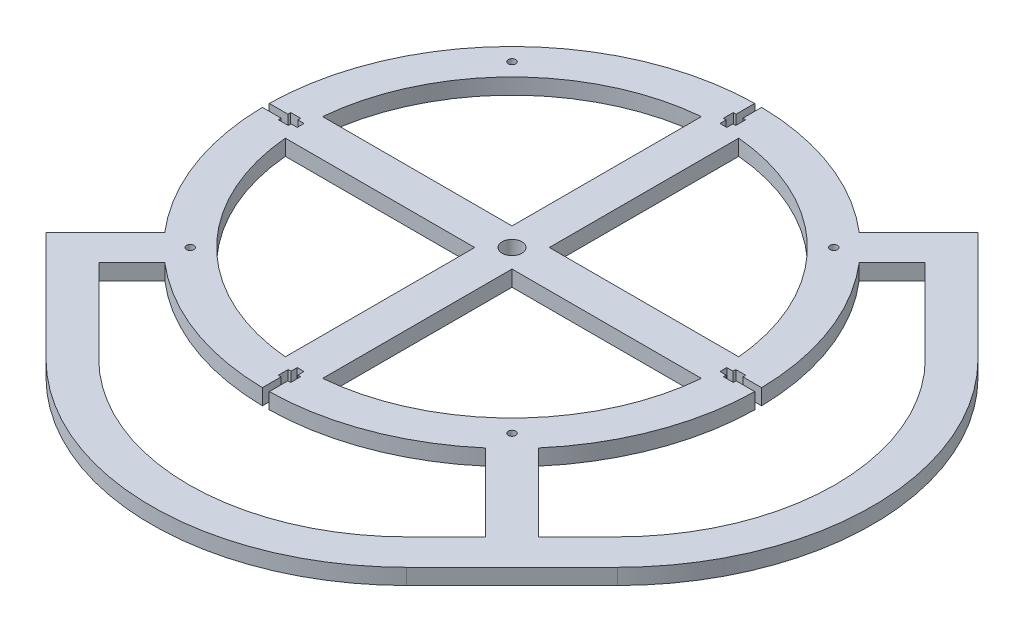
from build123d import *

# Parameters (mm, degrees)
BOSS_EXTRUDE1_DEPTH          = 3.175
SKETCH2_W                    = 2.75
SKETCH2_H                    = 2.5
SKETCH2_H_2                  = 4
SKETCH2_W_2                  = 1.125
SKETCH2_H_3                  = 7.5
CUT_EXTRUDE1_DEPTH           = 230.978807609
CIRPATTERN1_COUNT            = 4
F_3_0_3_DIAMETER_HOLE1_D     = 3
F_8_0_8_DIAMETER_HOLE1_D     = 8
F_8_0_8_DIAMETER_HOLE1_DEPTH = 6.35


with BuildPart() as part:
    # Sketch1 → Boss-Extrude1 (new, symmetric)
    with BuildSketch(Plane(origin=(0, 0, 0), x_dir=(1, 0, 0), z_dir=(0, 1, 0))):
        with BuildLine():
            Line((88.388347648, 98.994949366), (64.499098813, 75.105700531))
            ThreePointArc((64.499098813, 75.105700531), (-70.003571337, 70.003571337), (-75.105700531, -64.499098813))
            Line((-75.105700531, -64.499098813), (-98.994949366, -88.388347648))
            Line((-98.994949366, -88.388347648), (-54.800775542, -132.582521472))
            ThreePointArc((-54.800775542, -132.582521472), (17.67766953, -162.604076401), (90.156114601, -132.582521472))
            Line((90.156114601, -132.582521472), (132.582521472, -90.156114601))
            ThreePointArc((132.582521472, -90.156114601), (162.604076401, -17.67766953), (132.582521472, 54.800775542))
            Line((132.582521472, 54.800775542), (88.388347648, 98.994949366))
        make_face()
        with BuildLine():
            Line((-7.5, -7.5), (-7.5, -83.664508604))
            ThreePointArc((-7.5, -83.664508604), (-59.39696962, -59.39696962), (-83.664508604, -7.5))
            Line((-83.664508604, -7.5), (-7.5, -7.5))
        make_face(mode=Mode.SUBTRACT)
        with BuildLine():
            ThreePointArc((83.664508604, -7.5), (59.39696962, -59.39696962), (7.5, -83.664508604))
            Line((7.5, -83.664508604), (7.5, -7.5))
            Line((7.5, -7.5), (83.664508604, -7.5))
        make_face(mode=Mode.SUBTRACT)
        with BuildLine():
            ThreePointArc((-64.499098813, -75.105700531), (0, -99), (64.499098813, -75.105700531))
            Line((64.499098813, -75.105700531), (95.45941546, -106.066017178))
            Line((95.45941546, -106.066017178), (79.549512883, -121.975919755))
            ThreePointArc((79.549512883, -121.975919755), (17.67766953, -147.604076401), (-44.194173824, -121.975919755))
            Line((-44.194173824, -121.975919755), (-77.781745931, -88.388347648))
            Line((-77.781745931, -88.388347648), (-64.499098813, -75.105700531))
        make_face(mode=Mode.SUBTRACT)
        with BuildLine():
            ThreePointArc((75.105700531, -64.499098813), (99, 0), (75.105700531, 64.499098813))
            Line((75.105700531, 64.499098813), (88.388347648, 77.781745931))
            Line((88.388347648, 77.781745931), (121.975919755, 44.194173824))
            ThreePointArc((121.975919755, 44.194173824), (147.604076401, -17.67766953), (121.975919755, -79.549512883))
            Line((121.975919755, -79.549512883), (106.066017178, -95.45941546))
            Line((106.066017178, -95.45941546), (75.105700531, -64.499098813))
        make_face(mode=Mode.SUBTRACT)
        with BuildLine():
            Line((-7.5, 7.5), (-83.664508604, 7.5))
            ThreePointArc((-83.664508604, 7.5), (-59.39696962, 59.39696962), (-7.5, 83.664508604))
            Line((-7.5, 83.664508604), (-7.5, 7.5))
        make_face(mode=Mode.SUBTRACT)
        with BuildLine():
            ThreePointArc((7.5, 83.664508604), (59.39696962, 59.39696962), (83.664508604, 7.5))
            Line((83.664508604, 7.5), (7.5, 7.5))
            Line((7.5, 7.5), (7.5, 83.664508604))
        make_face(mode=Mode.SUBTRACT)
    extrude(amount=BOSS_EXTRUDE1_DEPTH, both=True)

    # Sketch2 → Cut-Extrude1 (cut, symmetric)
    with BuildSketch(Plane(origin=(0, 0, 0), x_dir=(1, 0, 0), z_dir=(0, 1, 0))):
        with Locations((0, 86.25)):
            Rectangle(SKETCH2_W, SKETCH2_H)
        with Locations((0, 89.5)):
            Rectangle(SKETCH2_W, SKETCH2_H_2)
        with Locations((1.9375, 89.5)):
            Rectangle(SKETCH2_W_2, SKETCH2_H_2)
        with Locations((0, 95.25)):
            Rectangle(SKETCH2_W, SKETCH2_H_3)
        with Locations((-1.9375, 89.5)):
            Rectangle(SKETCH2_W_2, SKETCH2_H_2)
    cut_extrude1 = extrude(amount=CUT_EXTRUDE1_DEPTH, both=True, mode=Mode.SUBTRACT)

    # CirPattern1: Cut-Extrude1 ×4 about axis
    cirpattern1_axis = Axis((0, 0, 0), (0, 1, 0))
    for i in range(1, CIRPATTERN1_COUNT):
        add(cut_extrude1.rotate(cirpattern1_axis, i * 360 / CIRPATTERN1_COUNT), mode=Mode.SUBTRACT)

    # Ø3.0 (3) Diameter Hole1 (through all)
    with Locations(Plane(origin=(0, 3.175, 0), x_dir=(1, 0, 0), z_dir=(0, 1, 0))):
        with Locations((-64.700270479, -64.700270479), (0, 0), (-64.700270479, 64.700270479), (64.700270479, 64.700270479), (64.700270479, -64.700270479)):
            Hole(F_3_0_3_DIAMETER_HOLE1_D / 2)

    # Ø8.0 (8) Diameter Hole1
    with Locations(Plane(origin=(0, 3.175, 0), x_dir=(1, 0, 0), z_dir=(0, 1, 0))):
        with Locations((0, 0)):
            Hole(F_8_0_8_DIAMETER_HOLE1_D / 2, depth=F_8_0_8_DIAMETER_HOLE1_DEPTH)


solid = part.part
